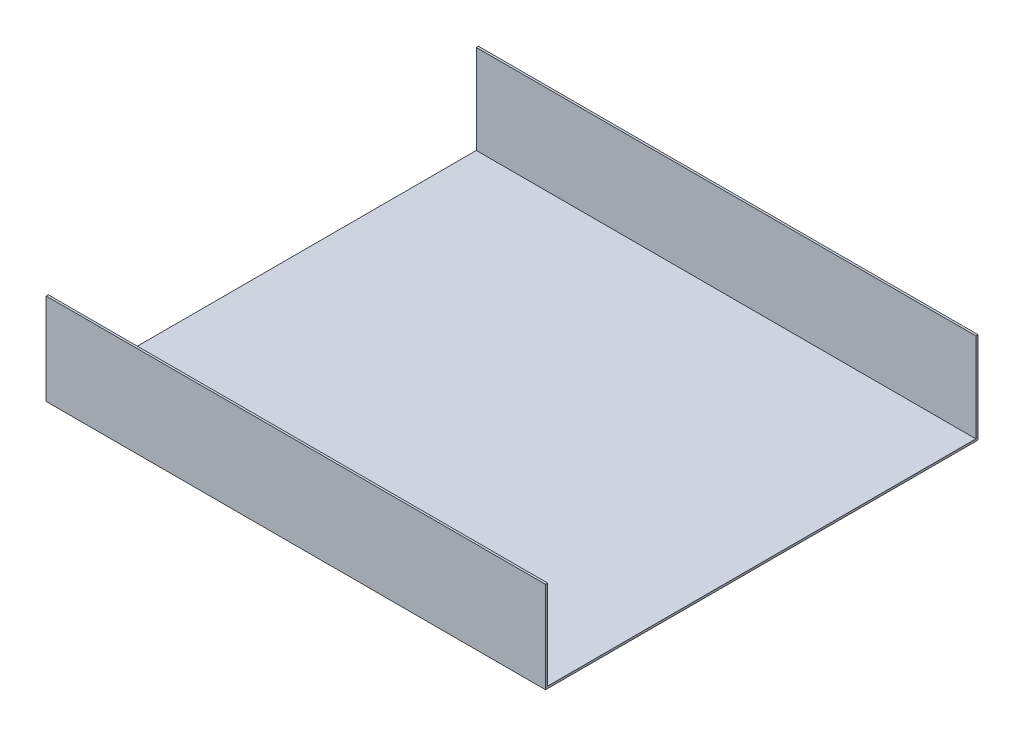
from build123d import *

# Parameters (mm, degrees)
CROQUIS1_W              = 120
CROQUIS1_H              = 25
SALIENTE_EXTRUIR1_DEPTH = 140
VACIADO1_T              = 0.6


with BuildPart() as part:
    # Croquis1 → Saliente-Extruir1 (new body)
    with BuildSketch(Plane(origin=(0, 0, 0), x_dir=(0, 0, -1), z_dir=(1, 0, 0))):
        with Locations((60, 12.5)):
            Rectangle(CROQUIS1_W, CROQUIS1_H)
    extrude(amount=SALIENTE_EXTRUIR1_DEPTH)

    # Vaciado1
    vaciado1_openings = [part.faces().sort_by_distance(p)[0] for p in [
        (70, 25, -60),
        (0, 12.5, -60),
        (140, 12.5, -60),
    ]]
    offset(amount=VACIADO1_T, openings=vaciado1_openings, kind=Kind.INTERSECTION)


solid = part.part
